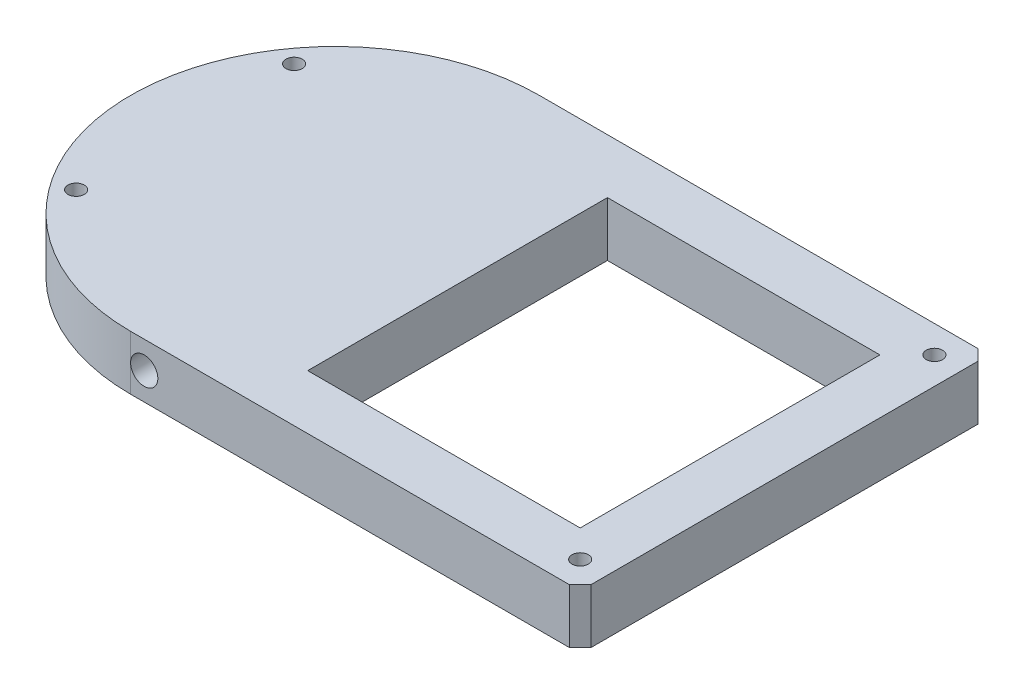
from build123d import *

# Parameters (mm, degrees)
EXTRUDE_1_DEPTH     = 10
SKETCH_2_R          = 2.5
CUT_EXTRUDE_1_DEPTH = 112.943065886
SKETCH_3_R          = 1.5
CUT_EXTRUDE_2_DEPTH = 92.172912644
SKETCH_4_W          = 50
SKETCH_4_H          = 55
CUT_EXTRUDE_3_DEPTH = 92.172912644
CHAMFER_1_SIZE      = 2


with BuildPart() as part:
    # 草图1 → 凸台-拉伸1 (new body)
    with BuildSketch(Plane(origin=(0, 0, 0), x_dir=(1, 0, 0), z_dir=(0, 1, 0))):
        with BuildLine():
            Line((0, 37.5), (82.5, 37.5))
            Line((82.5, 37.5), (82.5, -37.5))
            Line((82.5, -37.5), (0, -37.5))
            ThreePointArc((0, -37.5), (-37.5, 0), (0, 37.5))
        make_face()
    extrude(amount=EXTRUDE_1_DEPTH)

    # 草图2 → 切除-拉伸1 (cut, through all)
    with BuildSketch(Plane.XY.offset(37.5)):
        with Locations(Location((2.5, 5, 0), (0, 0, 180))):
            Circle(SKETCH_2_R)
    extrude(amount=-CUT_EXTRUDE_1_DEPTH, mode=Mode.SUBTRACT)

    # 草图3 → 切除-拉伸2 (cut, through all)
    with BuildSketch(Plane(origin=(0, 10, 0), x_dir=(1, 0, 0), z_dir=(0, 1, 0))):
        with Locations(Location((-27.5, 20, 0), (0, 0, 270))):
            Circle(SKETCH_3_R)
        with Locations(Location((-27.5, -20, 0), (0, 0, 270))):
            Circle(SKETCH_3_R)
        with Locations(Location((77.5, 32.5, 0), (0, 0, 270))):
            Circle(SKETCH_3_R)
        with Locations(Location((77.5, -32.5, 0), (0, 0, 270))):
            Circle(SKETCH_3_R)
    extrude(amount=-CUT_EXTRUDE_2_DEPTH, mode=Mode.SUBTRACT)

    # 草图4 → 切除-拉伸3 (cut, through all)
    with BuildSketch(Plane(origin=(0, 10, 0), x_dir=(1, 0, 0), z_dir=(0, 1, 0))):
        with Locations((47.5, 0)):
            Rectangle(SKETCH_4_W, SKETCH_4_H)
    extrude(amount=-CUT_EXTRUDE_3_DEPTH, mode=Mode.SUBTRACT)

    # 倒角1
    chamfer_1_edges = [part.edges().sort_by_distance(p)[0] for p in [
        (82.5, 5, -37.5),
        (82.5, 5, 37.5),
    ]]
    chamfer(chamfer_1_edges, length=CHAMFER_1_SIZE)


solid = part.part
